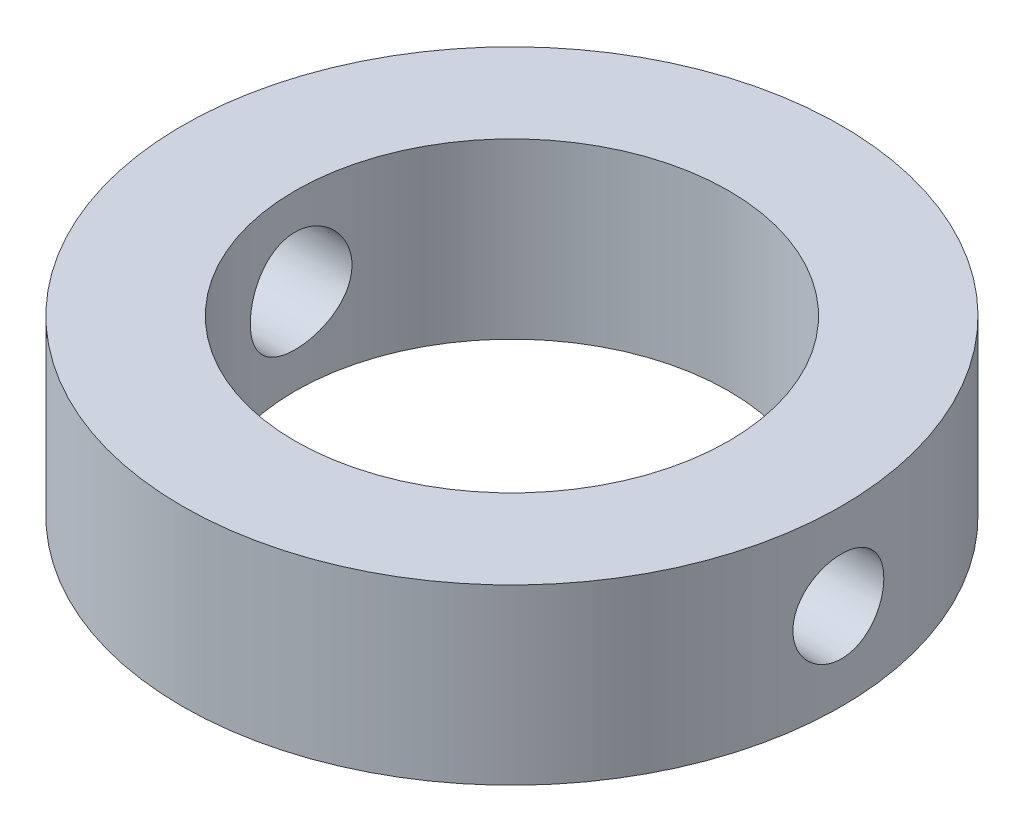
from build123d import *

# Parameters (mm, degrees)
SKETCH1_R           = 19
SKETCH1_R_2         = 12.5
BOSS_EXTRUDE1_DEPTH = 5


with BuildPart() as part:
    # Sketch1 → Boss-Extrude1 (new, symmetric)
    with BuildSketch(Plane(origin=(0, 0, 0), x_dir=(1, 0, 0), z_dir=(0, 1, 0))):
        with Locations(Location((0, 0, 0), (0, 0, 270))):
            Circle(SKETCH1_R)
        with Locations(Location((0, 0, 0), (0, 0, 270))):
            Circle(SKETCH1_R_2, mode=Mode.SUBTRACT)
    extrude(amount=BOSS_EXTRUDE1_DEPTH, both=True)

    # Sketch2 → Cut-Revolve1 (revolve, cut)
    with BuildSketch(Plane.XY, mode=Mode.PRIVATE) as cut_revolve1_sk:
        Polygon((-19, 0), (-19, 3), (19, 2.62), (19, 0), align=None)
    revolve(cut_revolve1_sk.sketch.rotate(Axis((0, 0, 0), (1, 0, 0)), 226.832059939), axis=Axis((0, 0, 0), (1, 0, 0)), mode=Mode.SUBTRACT)


solid = part.part
